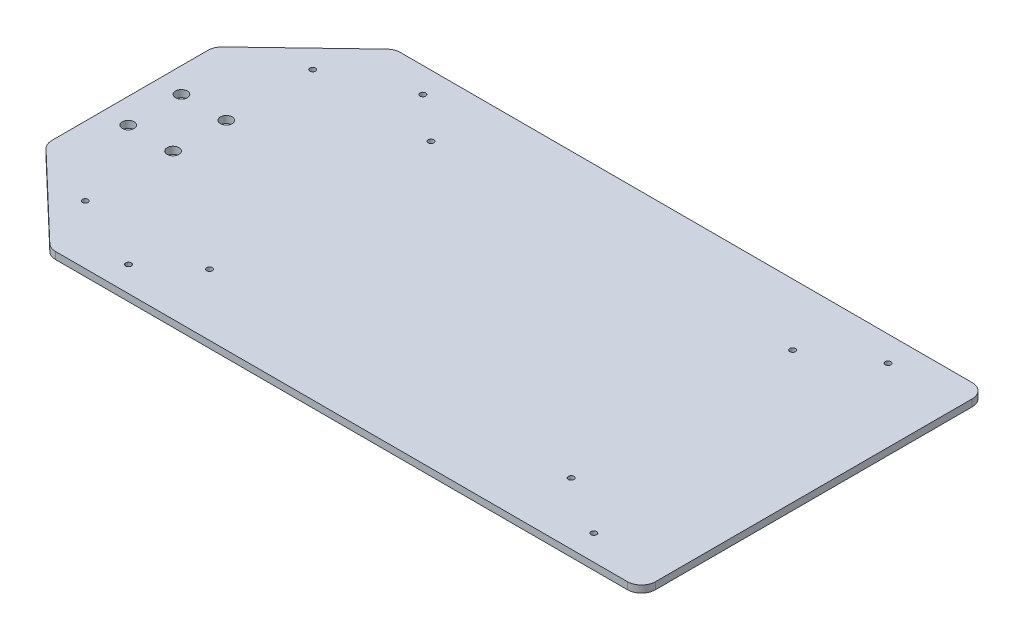
from build123d import *

# Parameters (mm, degrees)
EXTRUDE_2_DEPTH     = 2.5
SKETCH_2_R          = 2.1
CUT_EXTRUDE_1_DEPTH = 127.049593415
SKETCH_3_R          = 1
CUT_EXTRUDE_2_DEPTH = 127.049593415
SKETCH_4_R          = 1
CUT_EXTRUDE_3_DEPTH = 127.049593415
SKETCH_5_W          = 123
SKETCH_5_H          = 2.5
EXTRUDE_3_DEPTH     = 24
FILLET_1_R          = 5
SKETCH_6_R          = 1
CUT_EXTRUDE_4_DEPTH = 148.460164112


with BuildPart() as part:
    # 草图1 → 凸台-拉伸2 (new body)
    with BuildSketch(Plane(origin=(0, 0, 0), x_dir=(1, 0, 0), z_dir=(0, 1, 0))):
        Polygon((-77, 61.5), (-110, 30), (-110, -30), (-77, -61.5), (110, -61.5), (110, 61.5), align=None)
    extrude(amount=EXTRUDE_2_DEPTH)

    # 草图2 → 切除-拉伸1 (cut, through all)
    with BuildSketch(Plane(origin=(0, 2.5, 0), x_dir=(1, 0, 0), z_dir=(0, 1, 0))):
        with Locations(Location((-101.103205615, 9.5, 0), (0, 0, 270))):
            Circle(SKETCH_2_R)
        with Locations(Location((-101.103205615, -9.5, 0), (0, 0, 270))):
            Circle(SKETCH_2_R)
        with Locations(Location((-85.103205615, 9.5, 0), (0, 0, 270))):
            Circle(SKETCH_2_R)
        with Locations(Location((-85.103205615, -9.5, 0), (0, 0, 270))):
            Circle(SKETCH_2_R)
    extrude(amount=-CUT_EXTRUDE_1_DEPTH, mode=Mode.SUBTRACT)

    # 草图3 → 切除-拉伸2 (cut, through all)
    with BuildSketch(Plane(origin=(0, 2.5, 0), x_dir=(1, 0, 0), z_dir=(0, 1, 0))):
        with Locations(Location((-58, 52.5, 0), (0, 0, 270))):
            Circle(SKETCH_3_R)
        with Locations(Location((-58, -52.5, 0), (0, 0, 270))):
            Circle(SKETCH_3_R)
        with Locations(Location((108, -52.5, 0), (0, 0, 270))):
            Circle(SKETCH_3_R)
        with Locations(Location((108, 52.5, 0), (0, 0, 270))):
            Circle(SKETCH_3_R)
    extrude(amount=-CUT_EXTRUDE_2_DEPTH, mode=Mode.SUBTRACT)

    # 草图4 → 切除-拉伸3 (cut, through all)
    with BuildSketch(Plane.XZ):
        with Locations(Location((-42.09228043, 39.5, 0), (0, 0, 270))):
            Circle(SKETCH_4_R)
        with Locations(Location((-42.09228043, -39.5, 0), (0, 0, 270))):
            Circle(SKETCH_4_R)
        with Locations(Location((86.90771957, 39.5, 0), (0, 0, 270))):
            Circle(SKETCH_4_R)
        with Locations(Location((86.90771957, -39.5, 0), (0, 0, 270))):
            Circle(SKETCH_4_R)
    extrude(amount=-CUT_EXTRUDE_3_DEPTH, mode=Mode.SUBTRACT)

    # 草图5 → 凸台-拉伸3 (add)
    with BuildSketch(Plane(origin=(110, 0, 0), x_dir=(0, 0, -1), z_dir=(1, 0, 0))):
        with Locations((0, 1.25)):
            Rectangle(SKETCH_5_W, SKETCH_5_H)
    extrude(amount=EXTRUDE_3_DEPTH)

    # 圆角1
    fillet_1_edges = [part.edges().sort_by_distance(p)[0] for p in [
        (-110, 1.25, -30),
        (-77, 1.25, -61.5),
        (-77, 1.25, 61.5),
        (-110, 1.25, 30),
        (134, 1.25, 61.5),
        (134, 1.25, -61.5),
    ]]
    fillet(fillet_1_edges, radius=FILLET_1_R)

    # 草图6 → 切除-拉伸4 (cut, through all)
    with BuildSketch(Plane(origin=(0, 2.5, 0), x_dir=(1, 0, 0), z_dir=(0, 1, 0))):
        with Locations(Location((-85.354419484, 40.563392731, 0), (0, 0, 270))):
            Circle(SKETCH_6_R)
        with Locations(Location((-85.354419484, -40.563392731, 0), (0, 0, 270))):
            Circle(SKETCH_6_R)
    extrude(amount=-CUT_EXTRUDE_4_DEPTH, mode=Mode.SUBTRACT)


solid = part.part
